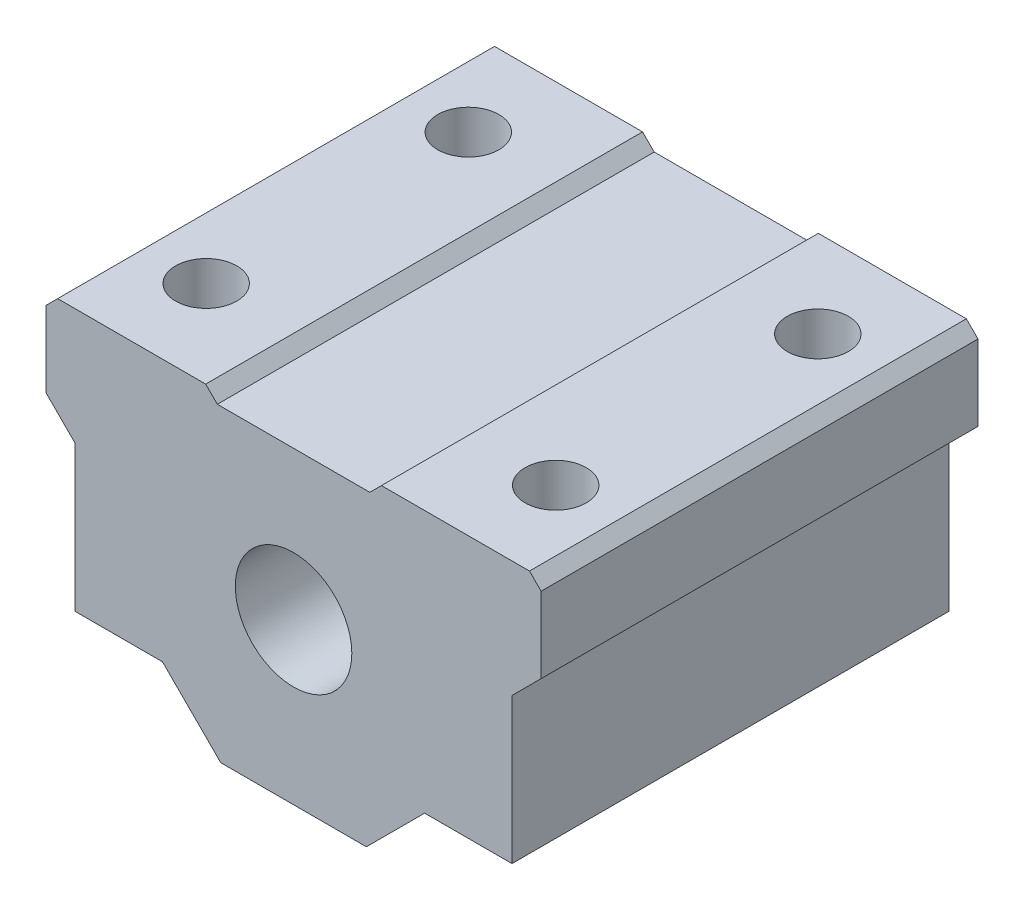
from build123d import *

# Parameters (mm, degrees)
SKETCH_1_R          = 4
EXTRUDE_1_DEPTH     = 30
SKETCH_2_R          = 2.1
CUT_EXTRUDE_1_DEPTH = 30


with BuildPart() as part:
    # 草图1 → 凸台-拉伸1 (new body)
    with BuildSketch(Plane.XY):
        Polygon((5, -11), (-5, -11), (-9, -7), (-15, -7), (-15, 3), (-17, 5), (-17, 10.2), (-16.2, 11), (-6.034999107, 11), (-5.234999107, 10.2), (5.234999107, 10.2), (6.034999107, 11), (16.2, 11), (17, 10.2), (17, 5), (15, 3), (15, -7), (9, -7), align=None)
        Circle(SKETCH_1_R, mode=Mode.SUBTRACT)
    extrude(amount=EXTRUDE_1_DEPTH)

    # 草图2 → 切除-拉伸1 (cut)
    with BuildSketch(Plane(origin=(0, 11, 0), x_dir=(1, 0, 0), z_dir=(0, 1, 0))):
        with Locations(Location((-12, -6, 0), (0, 0, 270))):
            Circle(SKETCH_2_R)
        with Locations(Location((-12, -24, 0), (0, 0, 270))):
            Circle(SKETCH_2_R)
        with Locations(Location((12, -6, 0), (0, 0, 180))):
            Circle(SKETCH_2_R)
        with Locations(Location((12, -24, 0), (0, 0, 180))):
            Circle(SKETCH_2_R)
    extrude(amount=-CUT_EXTRUDE_1_DEPTH, mode=Mode.SUBTRACT)


solid = part.part
